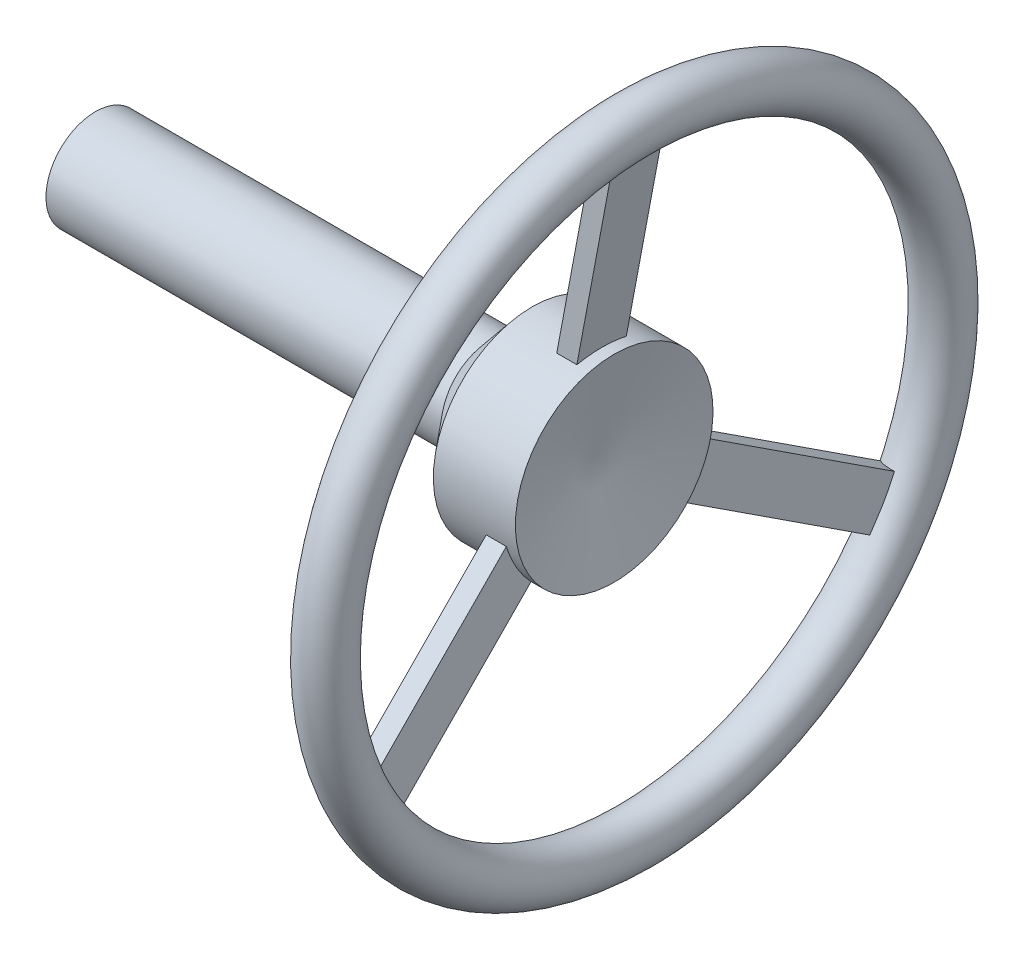
from build123d import *

# Parameters (mm, degrees)
IZIM2_R                     = 2.5
Y_KSEKLIK_EKSTR_ZYON1_DEPTH = 2.5
DAIRESEL_KAPLAMA1_COUNT     = 3


with BuildPart() as part:
    # Çizim1 → Döndür2 (revolve)
    with BuildSketch(Plane.XY):
        Polygon((0.472431585, 0), (0.472431585, 5), (40.472431585, 5), (44.667929741, 10), (52.967929741, 10), (50.88702434, 0), align=None)
    revolve(axis=Axis((0.472431585, 0, 0), (-1, 0, 0)))



with BuildPart() as body_2:
    # Çizim2 → Döndür3 (revolve)
    with BuildSketch(Plane.XY, mode=Mode.PRIVATE) as d_nd_r3_sk:
        with Locations((55, 31.25)):
            Circle(IZIM2_R)
    revolve(d_nd_r3_sk.sketch.rotate(Axis((0, 0, 0), (1, 0, 0)), 90), axis=Axis((0, 0, 0), (1, 0, 0)))


with BuildPart() as part_1:
    add(part.part)

    add(body_2.part)  # Yükseklik-Ekstrüzyon1 merges body 2
    # Çizim3 → Yükseklik-Ekstrüzyon1 (add, symmetric)
    with BuildSketch(Plane.XY):
        Polygon((51.6, 9.2), (49.564913151, 9.2), (53.984913151, 32.693820177), (56.02, 32.693820177), align=None)
    y_kseklik_ekstr_zyon1 = extrude(amount=Y_KSEKLIK_EKSTR_ZYON1_DEPTH, both=True)

    # Dairesel Kaplama1: Yükseklik-Ekstrüzyon1 ×3 about axis
    dairesel_kaplama1_axis = Axis((0, 0, 0), (1, 0, 0))
    for i in range(1, DAIRESEL_KAPLAMA1_COUNT):
        add(y_kseklik_ekstr_zyon1.rotate(dairesel_kaplama1_axis, i * 360 / DAIRESEL_KAPLAMA1_COUNT))


solid = part_1.part
